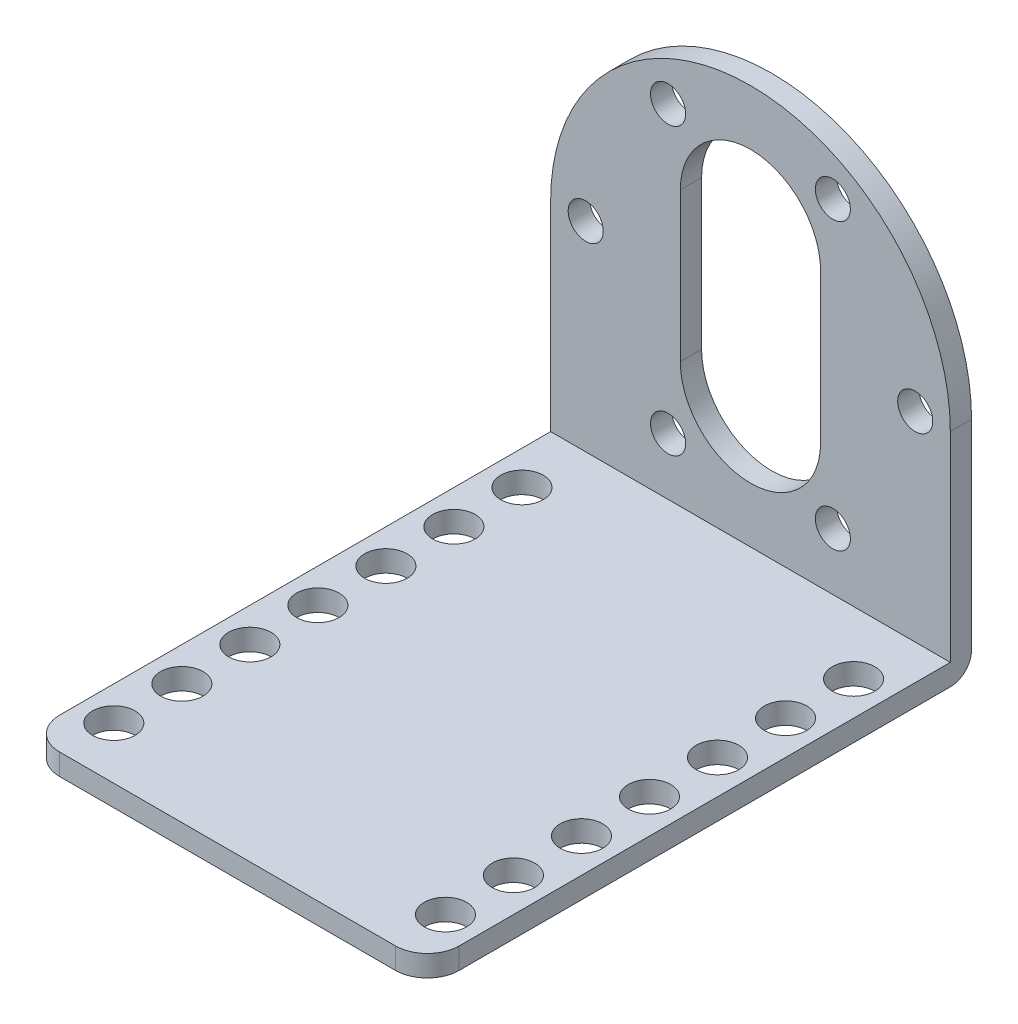
from build123d import *

# Parameters (mm, degrees)
BOSS_EXTRUDE1_DEPTH = 2
SKETCH2_W           = 37.6
SKETCH2_H           = 2
BOSS_EXTRUDE2_DEPTH = 49.2
FILLET1_R           = 2
FILLET2_R           = 3
CUT_EXTRUDE1_REACH  = 69.402
SKETCH3_R           = 2
CUT_EXTRUDE2_REACH  = 60.374
SKETCH4_R           = 1.65


with BuildPart() as part:
    # Sketch1 → Boss-Extrude1 (new body)
    with BuildSketch(Plane.XY):
        with BuildLine():
            Line((-18.8, 0), (-18.8, -20.8))
            Line((-18.8, -20.8), (18.8, -20.8))
            Line((18.8, -20.8), (18.8, 0))
            ThreePointArc((18.8, 0), (0, 18.8), (-18.8, 0))
        make_face()
    extrude(amount=BOSS_EXTRUDE1_DEPTH)

    # Sketch2 → Boss-Extrude2 (add)
    with BuildSketch(Plane.XY.offset(2)):
        with Locations((0, -19.8)):
            Rectangle(SKETCH2_W, SKETCH2_H)
    extrude(amount=BOSS_EXTRUDE2_DEPTH)

    # Fillet1
    fillet1_edges = [part.edges().sort_by_distance(p)[0] for p in [
        (0, -20.8, 0),
    ]]
    fillet(fillet1_edges, radius=FILLET1_R)

    # Fillet2
    fillet2_edges = [part.edges().sort_by_distance(p)[0] for p in [
        (-18.8, -19.8, 51.2),
        (18.8, -19.8, 51.2),
    ]]
    fillet(fillet2_edges, radius=FILLET2_R)

    # Sketch3 → Cut-Extrude1 (cut, up to next)
    with BuildSketch(Plane.XZ.offset(20.8), mode=Mode.PRIVATE) as cut_extrude1_sk1:
        with Locations(Location((-15.6, 46.3, 0), (0, 0, 270))):
            Circle(SKETCH3_R)
    cut_extrude1_tool1 = extrude(cut_extrude1_sk1.sketch, amount=-CUT_EXTRUDE1_REACH, mode=Mode.PRIVATE) & part.part
    # Sketch3 → Cut-Extrude1 (cut, up to next)
    with BuildSketch(Plane.XZ.offset(20.8), mode=Mode.PRIVATE) as cut_extrude1_sk2:
        with Locations(Location((15.6, 46.3, 0), (0, 0, 270))):
            Circle(SKETCH3_R)
    cut_extrude1_tool2 = extrude(cut_extrude1_sk2.sketch, amount=-CUT_EXTRUDE1_REACH, mode=Mode.PRIVATE) & part.part
    # Sketch3 → Cut-Extrude1 (cut, up to next)
    with BuildSketch(Plane.XZ.offset(20.8), mode=Mode.PRIVATE) as cut_extrude1_sk3:
        with Locations(Location((-15.6, 39.9, 0), (0, 0, 270))):
            Circle(SKETCH3_R)
    cut_extrude1_tool3 = extrude(cut_extrude1_sk3.sketch, amount=-CUT_EXTRUDE1_REACH, mode=Mode.PRIVATE) & part.part
    # Sketch3 → Cut-Extrude1 (cut, up to next)
    with BuildSketch(Plane.XZ.offset(20.8), mode=Mode.PRIVATE) as cut_extrude1_sk4:
        with Locations(Location((15.6, 39.9, 0), (0, 0, 270))):
            Circle(SKETCH3_R)
    cut_extrude1_tool4 = extrude(cut_extrude1_sk4.sketch, amount=-CUT_EXTRUDE1_REACH, mode=Mode.PRIVATE) & part.part
    # Sketch3 → Cut-Extrude1 (cut, up to next)
    with BuildSketch(Plane.XZ.offset(20.8), mode=Mode.PRIVATE) as cut_extrude1_sk5:
        with Locations(Location((-15.6, 33.5, 0), (0, 0, 270))):
            Circle(SKETCH3_R)
    cut_extrude1_tool5 = extrude(cut_extrude1_sk5.sketch, amount=-CUT_EXTRUDE1_REACH, mode=Mode.PRIVATE) & part.part
    # Sketch3 → Cut-Extrude1 (cut, up to next)
    with BuildSketch(Plane.XZ.offset(20.8), mode=Mode.PRIVATE) as cut_extrude1_sk6:
        with Locations(Location((15.6, 33.5, 0), (0, 0, 270))):
            Circle(SKETCH3_R)
    cut_extrude1_tool6 = extrude(cut_extrude1_sk6.sketch, amount=-CUT_EXTRUDE1_REACH, mode=Mode.PRIVATE) & part.part
    # Sketch3 → Cut-Extrude1 (cut, up to next)
    with BuildSketch(Plane.XZ.offset(20.8), mode=Mode.PRIVATE) as cut_extrude1_sk7:
        with Locations(Location((-15.6, 27.1, 0), (0, 0, 270))):
            Circle(SKETCH3_R)
    cut_extrude1_tool7 = extrude(cut_extrude1_sk7.sketch, amount=-CUT_EXTRUDE1_REACH, mode=Mode.PRIVATE) & part.part
    # Sketch3 → Cut-Extrude1 (cut, up to next)
    with BuildSketch(Plane.XZ.offset(20.8), mode=Mode.PRIVATE) as cut_extrude1_sk8:
        with Locations(Location((15.6, 27.1, 0), (0, 0, 270))):
            Circle(SKETCH3_R)
    cut_extrude1_tool8 = extrude(cut_extrude1_sk8.sketch, amount=-CUT_EXTRUDE1_REACH, mode=Mode.PRIVATE) & part.part
    # Sketch3 → Cut-Extrude1 (cut, up to next)
    with BuildSketch(Plane.XZ.offset(20.8), mode=Mode.PRIVATE) as cut_extrude1_sk9:
        with Locations(Location((-15.6, 20.7, 0), (0, 0, 270))):
            Circle(SKETCH3_R)
    cut_extrude1_tool9 = extrude(cut_extrude1_sk9.sketch, amount=-CUT_EXTRUDE1_REACH, mode=Mode.PRIVATE) & part.part
    # Sketch3 → Cut-Extrude1 (cut, up to next)
    with BuildSketch(Plane.XZ.offset(20.8), mode=Mode.PRIVATE) as cut_extrude1_sk10:
        with Locations(Location((15.6, 20.7, 0), (0, 0, 270))):
            Circle(SKETCH3_R)
    cut_extrude1_tool10 = extrude(cut_extrude1_sk10.sketch, amount=-CUT_EXTRUDE1_REACH, mode=Mode.PRIVATE) & part.part
    # Sketch3 → Cut-Extrude1 (cut, up to next)
    with BuildSketch(Plane.XZ.offset(20.8), mode=Mode.PRIVATE) as cut_extrude1_sk11:
        with Locations(Location((-15.6, 14.3, 0), (0, 0, 270))):
            Circle(SKETCH3_R)
    cut_extrude1_tool11 = extrude(cut_extrude1_sk11.sketch, amount=-CUT_EXTRUDE1_REACH, mode=Mode.PRIVATE) & part.part
    # Sketch3 → Cut-Extrude1 (cut, up to next)
    with BuildSketch(Plane.XZ.offset(20.8), mode=Mode.PRIVATE) as cut_extrude1_sk12:
        with Locations(Location((15.6, 14.3, 0), (0, 0, 270))):
            Circle(SKETCH3_R)
    cut_extrude1_tool12 = extrude(cut_extrude1_sk12.sketch, amount=-CUT_EXTRUDE1_REACH, mode=Mode.PRIVATE) & part.part
    # Sketch3 → Cut-Extrude1 (cut, up to next)
    with BuildSketch(Plane.XZ.offset(20.8), mode=Mode.PRIVATE) as cut_extrude1_sk13:
        with Locations(Location((-15.6, 7.9, 0), (0, 0, 270))):
            Circle(SKETCH3_R)
    cut_extrude1_tool13 = extrude(cut_extrude1_sk13.sketch, amount=-CUT_EXTRUDE1_REACH, mode=Mode.PRIVATE) & part.part
    # Sketch3 → Cut-Extrude1 (cut, up to next)
    with BuildSketch(Plane.XZ.offset(20.8), mode=Mode.PRIVATE) as cut_extrude1_sk14:
        with Locations(Location((15.6, 7.9, 0), (0, 0, 270))):
            Circle(SKETCH3_R)
    cut_extrude1_tool14 = extrude(cut_extrude1_sk14.sketch, amount=-CUT_EXTRUDE1_REACH, mode=Mode.PRIVATE) & part.part
    add(cut_extrude1_tool1.solids().sort_by_distance((-15.6, -20.8, 46.3))[0], mode=Mode.SUBTRACT)
    add(cut_extrude1_tool2.solids().sort_by_distance((15.6, -20.8, 46.3))[0], mode=Mode.SUBTRACT)
    add(cut_extrude1_tool3.solids().sort_by_distance((-15.6, -20.8, 39.9))[0], mode=Mode.SUBTRACT)
    add(cut_extrude1_tool4.solids().sort_by_distance((15.6, -20.8, 39.9))[0], mode=Mode.SUBTRACT)
    add(cut_extrude1_tool5.solids().sort_by_distance((-15.6, -20.8, 33.5))[0], mode=Mode.SUBTRACT)
    add(cut_extrude1_tool6.solids().sort_by_distance((15.6, -20.8, 33.5))[0], mode=Mode.SUBTRACT)
    add(cut_extrude1_tool7.solids().sort_by_distance((-15.6, -20.8, 27.1))[0], mode=Mode.SUBTRACT)
    add(cut_extrude1_tool8.solids().sort_by_distance((15.6, -20.8, 27.1))[0], mode=Mode.SUBTRACT)
    add(cut_extrude1_tool9.solids().sort_by_distance((-15.6, -20.8, 20.7))[0], mode=Mode.SUBTRACT)
    add(cut_extrude1_tool10.solids().sort_by_distance((15.6, -20.8, 20.7))[0], mode=Mode.SUBTRACT)
    add(cut_extrude1_tool11.solids().sort_by_distance((-15.6, -20.8, 14.3))[0], mode=Mode.SUBTRACT)
    add(cut_extrude1_tool12.solids().sort_by_distance((15.6, -20.8, 14.3))[0], mode=Mode.SUBTRACT)
    add(cut_extrude1_tool13.solids().sort_by_distance((-15.6, -20.8, 7.9))[0], mode=Mode.SUBTRACT)
    add(cut_extrude1_tool14.solids().sort_by_distance((15.6, -20.8, 7.9))[0], mode=Mode.SUBTRACT)

    # Sketch4 → Cut-Extrude2 (cut, up to next)
    with BuildSketch(Plane(origin=(0, 0, 0), x_dir=(-1, 0, 0), z_dir=(0, 0, -1)), mode=Mode.PRIVATE) as cut_extrude2_sk1:
        with Locations((15.5, 0)):
            Circle(SKETCH4_R)
    cut_extrude2_tool1 = extrude(cut_extrude2_sk1.sketch, amount=-CUT_EXTRUDE2_REACH, mode=Mode.PRIVATE) & part.part
    # Sketch4 → Cut-Extrude2 (cut, up to next)
    with BuildSketch(Plane(origin=(0, 0, 0), x_dir=(-1, 0, 0), z_dir=(0, 0, -1)), mode=Mode.PRIVATE) as cut_extrude2_sk2:
        with Locations((7.75, -13.423393759)):
            Circle(SKETCH4_R)
    cut_extrude2_tool2 = extrude(cut_extrude2_sk2.sketch, amount=-CUT_EXTRUDE2_REACH, mode=Mode.PRIVATE) & part.part
    # Sketch4 → Cut-Extrude2 (cut, up to next)
    with BuildSketch(Plane(origin=(0, 0, 0), x_dir=(-1, 0, 0), z_dir=(0, 0, -1)), mode=Mode.PRIVATE) as cut_extrude2_sk3:
        with Locations((-7.75, -13.423393759)):
            Circle(SKETCH4_R)
    cut_extrude2_tool3 = extrude(cut_extrude2_sk3.sketch, amount=-CUT_EXTRUDE2_REACH, mode=Mode.PRIVATE) & part.part
    # Sketch4 → Cut-Extrude2 (cut, up to next)
    with BuildSketch(Plane(origin=(0, 0, 0), x_dir=(-1, 0, 0), z_dir=(0, 0, -1)), mode=Mode.PRIVATE) as cut_extrude2_sk4:
        with Locations((-15.5, 0)):
            Circle(SKETCH4_R)
    cut_extrude2_tool4 = extrude(cut_extrude2_sk4.sketch, amount=-CUT_EXTRUDE2_REACH, mode=Mode.PRIVATE) & part.part
    # Sketch4 → Cut-Extrude2 (cut, up to next)
    with BuildSketch(Plane(origin=(0, 0, 0), x_dir=(-1, 0, 0), z_dir=(0, 0, -1)), mode=Mode.PRIVATE) as cut_extrude2_sk5:
        with Locations((-7.75, 13.423393759)):
            Circle(SKETCH4_R)
    cut_extrude2_tool5 = extrude(cut_extrude2_sk5.sketch, amount=-CUT_EXTRUDE2_REACH, mode=Mode.PRIVATE) & part.part
    # Sketch4 → Cut-Extrude2 (cut, up to next)
    with BuildSketch(Plane(origin=(0, 0, 0), x_dir=(-1, 0, 0), z_dir=(0, 0, -1)), mode=Mode.PRIVATE) as cut_extrude2_sk6:
        with Locations((7.75, 13.423393759)):
            Circle(SKETCH4_R)
    cut_extrude2_tool6 = extrude(cut_extrude2_sk6.sketch, amount=-CUT_EXTRUDE2_REACH, mode=Mode.PRIVATE) & part.part
    # Sketch4 → Cut-Extrude2 (cut, up to next)
    with BuildSketch(Plane(origin=(0, 0, 0), x_dir=(-1, 0, 0), z_dir=(0, 0, -1)), mode=Mode.PRIVATE) as cut_extrude2_sk7:
        with BuildLine():
            Line((-6.6, 7), (-6.6, -7))
            ThreePointArc((-6.6, -7), (0, -13.6), (6.6, -7))
            Line((6.6, -7), (6.6, 7))
            ThreePointArc((6.6, 7), (0, 13.6), (-6.6, 7))
        make_face()
    cut_extrude2_tool7 = extrude(cut_extrude2_sk7.sketch, amount=-CUT_EXTRUDE2_REACH, mode=Mode.PRIVATE) & part.part
    add(cut_extrude2_tool1.solids().sort_by_distance((-15.5, 0, 0))[0], mode=Mode.SUBTRACT)
    add(cut_extrude2_tool2.solids().sort_by_distance((-7.75, -13.423394, 0))[0], mode=Mode.SUBTRACT)
    add(cut_extrude2_tool3.solids().sort_by_distance((7.75, -13.423394, 0))[0], mode=Mode.SUBTRACT)
    add(cut_extrude2_tool4.solids().sort_by_distance((15.5, 0, 0))[0], mode=Mode.SUBTRACT)
    add(cut_extrude2_tool5.solids().sort_by_distance((7.75, 13.423394, 0))[0], mode=Mode.SUBTRACT)
    add(cut_extrude2_tool6.solids().sort_by_distance((-7.75, 13.423394, 0))[0], mode=Mode.SUBTRACT)
    add(cut_extrude2_tool7.solids().sort_by_distance((0, 0, 0))[0], mode=Mode.SUBTRACT)


solid = part.part
